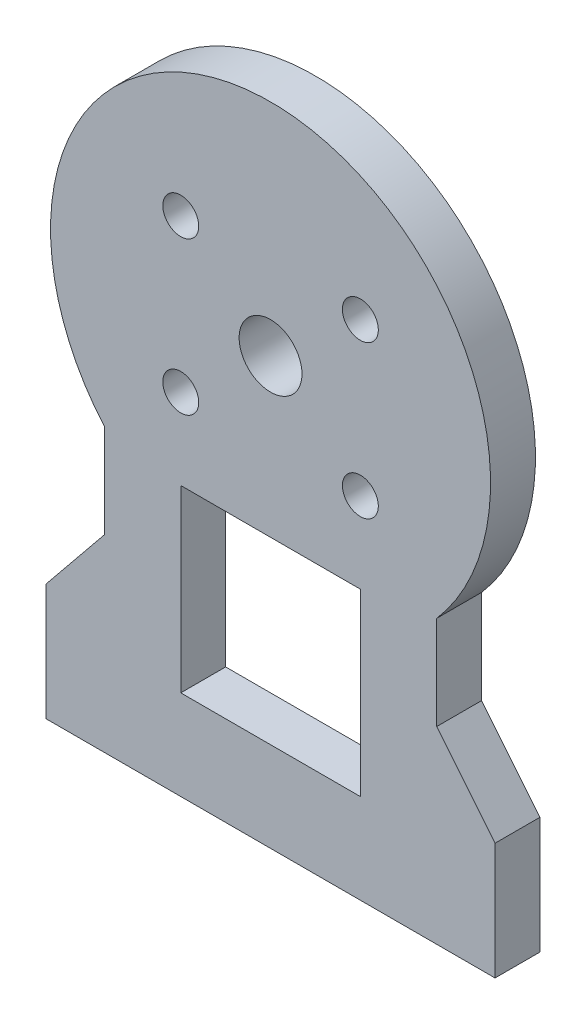
from build123d import *

# Parameters (mm, degrees)
SZKIC1_R                    = 1.75
SZKIC1_R_2                  = 1
SZKIC1_W                    = 10
SZKIC1_H                    = 10
DODANIE_WYCI_GNI_CIE1_DEPTH = 2.5


with BuildPart() as part:
    # Szkic1 → Dodanie-wyciągnięcie1 (new body)
    with BuildSketch(Plane.XY):
        with BuildLine():
            Line((12.5, 0), (-12.5, 0))
            Line((-12.5, 0), (-12.5, 6.5))
            Line((-12.5, 6.5), (-9.25, 10.5))
            Line((-9.25, 10.5), (-9.25, 15.718810798))
            ThreePointArc((-9.25, 15.718810798), (0, 36), (9.25, 15.718810798))
            Line((9.25, 15.718810798), (9.25, 10.5))
            Line((9.25, 10.5), (12.5, 6.5))
            Line((12.5, 6.5), (12.5, 0))
        make_face()
        with Locations((0, 23.75)):
            Circle(SZKIC1_R, mode=Mode.SUBTRACT)
        with Locations((-5, 28)):
            Circle(SZKIC1_R_2, mode=Mode.SUBTRACT)
        with Locations((-5, 19.5)):
            Circle(SZKIC1_R_2, mode=Mode.SUBTRACT)
        with Locations(Location((5, 19.5, 0), (0, 0, 180))):
            Circle(SZKIC1_R_2, mode=Mode.SUBTRACT)
        with Locations(Location((5, 28, 0), (0, 0, 180))):
            Circle(SZKIC1_R_2, mode=Mode.SUBTRACT)
        with Locations((0, 10)):
            Rectangle(SZKIC1_W, SZKIC1_H, mode=Mode.SUBTRACT)
    extrude(amount=DODANIE_WYCI_GNI_CIE1_DEPTH)


solid = part.part
